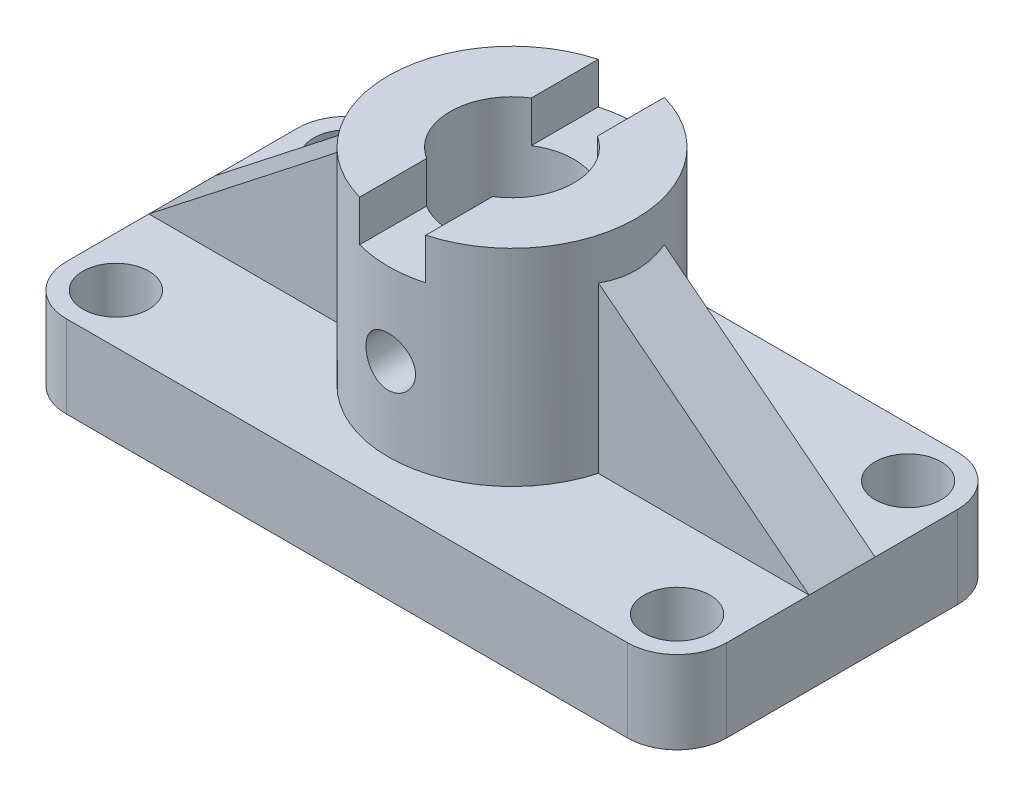
from build123d import *

# Parameters (mm, degrees)
SKETCH_2_R               = 4
EXTRUDE_1_DEPTH          = 10
SKETCH_2_3_R             = 15
SKETCH_2_3_R_2           = 7.5
EXTRUDE_2_DEPTH          = 35
EXTRUDE_START            = 10
EXTRUDE_3_DEPTH          = 20
EXTRUDE_3_2_DEPTH        = 20
CUT_EXTRUDE_1_DEPTH      = 59.318093247
CUT_EXTRUDE_START        = -5
CUT_EXTRUDE_2_DEPTH      = 5
CUT_EXTRUDE_3_DEPTH      = 57.789083458
CUT_EXTRUDE_3_DEPTH_BACK = 57.789083458
SKETCH_6_R               = 3


with BuildPart() as part:
    # 草图2 → 凸台-拉伸1 (new body)
    # profile 1 of 4: a face of its own
    with BuildSketch(Plane(origin=(0, 0, 0), x_dir=(1, 0, 0), z_dir=(0, 1, 0))):
        with BuildLine():
            Line((14.456832295, 4), (40, 4))
            Line((40, 4), (40, 14))
            ThreePointArc((40, 14), (38.242640687, 18.242640687), (34, 20))
            Line((34, 20), (-34, 20))
            ThreePointArc((-34, 20), (-38.242640687, 18.242640687), (-40, 14))
            Line((-40, 14), (-40, 4))
            Line((-40, 4), (-14.456832295, 4))
            ThreePointArc((-14.456832295, 4), (0, 15), (14.456832295, 4))
        make_face()
        with Locations(Location((-34, 14, 0), (0, 0, 270))):
            Circle(SKETCH_2_R, mode=Mode.SUBTRACT)
        with Locations(Location((34, 14, 0), (0, 0, 270))):
            Circle(SKETCH_2_R, mode=Mode.SUBTRACT)
    # profile 2 of 4: a face of its own
    with BuildSketch(Plane(origin=(0, 0, 0), x_dir=(1, 0, 0), z_dir=(0, 1, 0))):
        with BuildLine():
            Line((14.456832295, -4), (40, -4))
            Line((40, -4), (40, 4))
            Line((40, 4), (14.456832295, 4))
            ThreePointArc((14.456832295, 4), (14.863587797, 2.018355219), (15, 0))
            ThreePointArc((15, 0), (14.863587797, -2.018355219), (14.456832295, -4))
        make_face()
    # profile 3 of 4: a face of its own
    with BuildSketch(Plane(origin=(0, 0, 0), x_dir=(1, 0, 0), z_dir=(0, 1, 0))):
        with BuildLine():
            Line((-34, -20), (34, -20))
            ThreePointArc((34, -20), (38.242640687, -18.242640687), (40, -14))
            Line((40, -14), (40, -4))
            Line((40, -4), (14.456832295, -4))
            ThreePointArc((14.456832295, -4), (0, -15), (-14.456832295, -4))
            Line((-14.456832295, -4), (-40, -4))
            Line((-40, -4), (-40, -14))
            ThreePointArc((-40, -14), (-38.242640687, -18.242640687), (-34, -20))
        make_face()
        with Locations(Location((-34, -14, 0), (0, 0, 270))):
            Circle(SKETCH_2_R, mode=Mode.SUBTRACT)
        with Locations(Location((34, -14, 0), (0, 0, 270))):
            Circle(SKETCH_2_R, mode=Mode.SUBTRACT)
    # profile 4 of 4: a face of its own
    with BuildSketch(Plane(origin=(0, 0, 0), x_dir=(1, 0, 0), z_dir=(0, 1, 0))):
        with BuildLine():
            Line((-40, 4), (-40, -4))
            Line((-40, -4), (-14.456832295, -4))
            ThreePointArc((-14.456832295, -4), (-15, 0), (-14.456832295, 4))
            Line((-14.456832295, 4), (-40, 4))
        make_face()
    extrude(amount=EXTRUDE_1_DEPTH)

    # 草图2<3> → 凸台-拉伸2 (add)
    with BuildSketch(Plane(origin=(0, 0, 0), x_dir=(1, 0, 0), z_dir=(0, 1, 0))):
        with Locations(Location((0, 0, 0), (0, 0, 270))):
            Circle(SKETCH_2_3_R)
        with Locations(Location((0, 0, 0), (0, 0, 270))):
            Circle(SKETCH_2_3_R_2, mode=Mode.SUBTRACT)
    extrude(amount=EXTRUDE_2_DEPTH)

    # 草图5 → 切除-拉伸2 (cut)
    with BuildSketch(Plane(origin=(0, 35, 0), x_dir=(1, 0, 0), z_dir=(0, 1, 0)).offset(CUT_EXTRUDE_START)):
        with BuildLine():
            Line((-4, -14.456832295), (-4, 14.456832295))
            ThreePointArc((-4, 14.456832295), (0, 15), (4, 14.456832295))
            Line((4, 14.456832295), (4, -14.456832295))
            ThreePointArc((4, -14.456832295), (0, -15), (-4, -14.456832295))
        make_face()
    extrude(amount=CUT_EXTRUDE_2_DEPTH, mode=Mode.SUBTRACT)

    # 草图6 → 切除-拉伸3 (cut, two sides: drawn at the far end of the back side and taken through both)
    with BuildSketch(Plane.XY.offset(-CUT_EXTRUDE_3_DEPTH_BACK)):
        with Locations((0, 20)):
            Circle(SKETCH_6_R)
    extrude(amount=CUT_EXTRUDE_3_DEPTH + CUT_EXTRUDE_3_DEPTH_BACK, mode=Mode.SUBTRACT)


with BuildPart() as body_2:
    # 草图2<4> → 凸台-拉伸3 (new body)
    with BuildSketch(Plane(origin=(0, 0, 0), x_dir=(1, 0, 0), z_dir=(0, 1, 0)).offset(EXTRUDE_START)):
        with BuildLine():
            Line((-40, 4), (-40, -4))
            Line((-40, -4), (-14.456832295, -4))
            ThreePointArc((-14.456832295, -4), (-15, 0), (-14.456832295, 4))
            Line((-14.456832295, 4), (-40, 4))
        make_face()
    extrude(amount=EXTRUDE_3_DEPTH)


with BuildPart() as body_3:
    # 草图2<4> → Extrude 3 2 (new body)
    with BuildSketch(Plane(origin=(0, 0, 0), x_dir=(1, 0, 0), z_dir=(0, 1, 0)).offset(EXTRUDE_START)):
        with BuildLine():
            Line((14.456832295, -4), (40, -4))
            Line((40, -4), (40, 4))
            Line((40, 4), (14.456832295, 4))
            ThreePointArc((14.456832295, 4), (14.863587797, 2.018355219), (15, 0))
            ThreePointArc((15, 0), (14.863587797, -2.018355219), (14.456832295, -4))
        make_face()
    extrude(amount=EXTRUDE_3_2_DEPTH)


with BuildPart() as cut_extrude_1_tool:
    # 草图4 → 切除-拉伸1 (new, through all)
    with BuildSketch(Plane.XY.offset(4)):
        Polygon((-40, 10), (-14.456832295, 30), (-40, 30), align=None)
        Polygon((14.456832295, 30), (40, 10), (40, 30), align=None)
    extrude(amount=-CUT_EXTRUDE_1_DEPTH)


with BuildPart() as body_2_1:
    add(body_2.part)

    # 切除-拉伸1: cut by cut_extrude_1_tool
    add(cut_extrude_1_tool.part, mode=Mode.SUBTRACT)


with BuildPart() as body_3_1:
    add(body_3.part)

    # 切除-拉伸1: cut by cut_extrude_1_tool
    add(cut_extrude_1_tool.part, mode=Mode.SUBTRACT)


solid = Compound([part.part, body_2_1.part, body_3_1.part])
